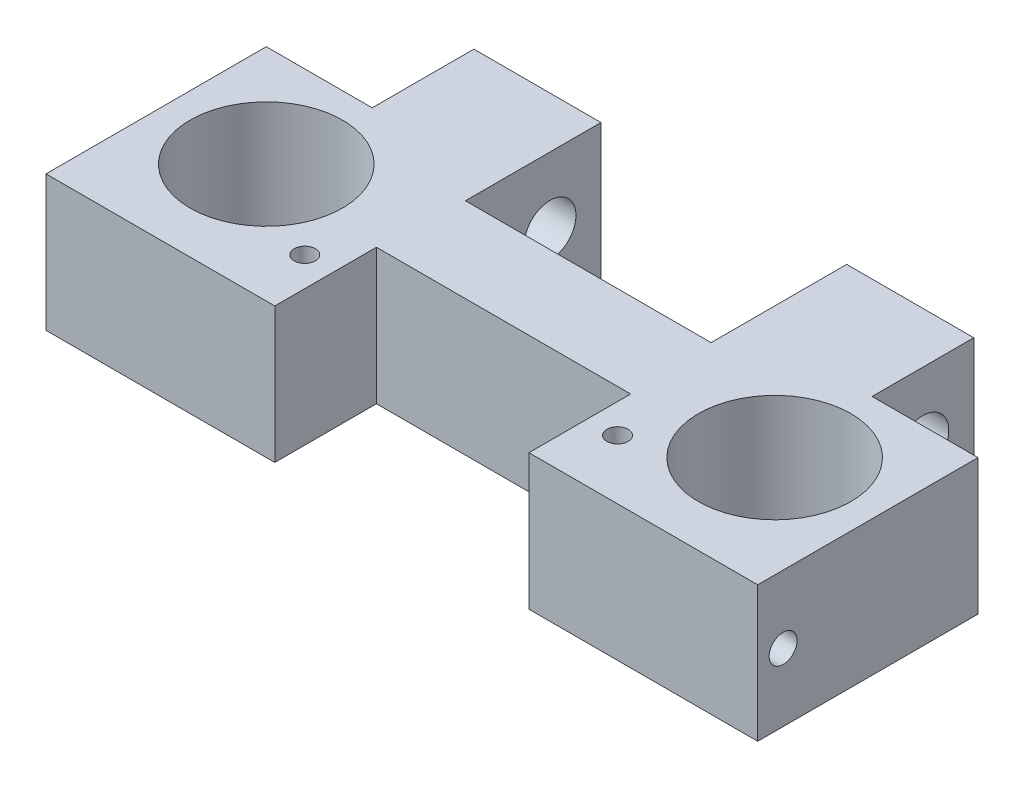
from build123d import *

# Parameters (mm, degrees)
SKETCH_1_R             = 9
EXTRUDE_1_DEPTH        = 8
SKETCH_7_R             = 3.05
CUT_EXTRUDE_1_DEPTH    = 77.165937269
CUT_EXTRUDE_2_REACH    = 53.43
SKETCH_10_W            = 30
SKETCH_10_H            = 12
HOLE_WIZARD_M3_1_D     = 2.5
HOLE_WIZARD_M3_1_DEPTH = 8.5
HOLE_WIZARD_M3_1_TIP   = 0.751075774


with BuildPart() as part:
    # 草图1 → 凸台-拉伸1 (new, symmetric)
    with BuildSketch(Plane(origin=(0, 0, 0), x_dir=(1, 0, 0), z_dir=(0, 1, 0))):
        Polygon((-42, -13), (42, -13), (42, 13), (29.5, 13), (29.5, 25), (14.5, 25), (14.5, 9), (-14.5, 9), (-14.5, 25), (-29.5, 25), (-29.5, 13), (-42, 13), align=None)
        with Locations(Location((-30, 1, 0), (0, 0, 270))):
            Circle(SKETCH_1_R, mode=Mode.SUBTRACT)
        with Locations(Location((30, 1, 0), (0, 0, 90))):
            Circle(SKETCH_1_R, mode=Mode.SUBTRACT)
    extrude(amount=EXTRUDE_1_DEPTH, both=True)

    # 草图7 → 切除-拉伸1 (cut, through all)
    with BuildSketch(Plane.ZY.offset(29.5)):
        with Locations((-19, 0)):
            Circle(SKETCH_7_R)
    extrude(amount=-CUT_EXTRUDE_1_DEPTH, mode=Mode.SUBTRACT)

    # 草图10 → 切除-拉伸2 (cut, up to next)
    with BuildSketch(Plane.XZ.offset(8), mode=Mode.PRIVATE) as cut_extrude_2_sk1:
        with Locations((0, 7)):
            Rectangle(SKETCH_10_W, SKETCH_10_H)
    cut_extrude_2_tool1 = extrude(cut_extrude_2_sk1.sketch, amount=-CUT_EXTRUDE_2_REACH, mode=Mode.PRIVATE) & part.part
    add(cut_extrude_2_tool1.solids().sort_by_distance((0, -8, 7))[0], mode=Mode.SUBTRACT)

    # 草图8 → M4 螺纹孔1 (revolve, cut)
    with BuildSketch(Plane(origin=(42, 0, 10), x_dir=(0, 0, -1), z_dir=(0, 1, 0))):
        Polygon((0, 0), (0, 10.491420021), (1.65, 9.5), (1.65, 0), align=None)
    hole_wizard_m4_1 = revolve(axis=Axis((48.35, 0, 10), (-1, 0, 0)), mode=Mode.SUBTRACT)

    # 镜向1: M4 螺纹孔1 across plane
    add(hole_wizard_m4_1.mirror(Plane(origin=(0, 0, 0), x_dir=(0, 0, 1), z_dir=(1, 0, 0))), mode=Mode.SUBTRACT)

    # M3 螺纹孔1
    with Locations(Plane(origin=(0, 8, 0), x_dir=(1, 0, 0), z_dir=(0, 1, 0))):
        with Locations((-18.456603619, -6), (18.456603619, -6)):
            Hole(HOLE_WIZARD_M3_1_D / 2, depth=HOLE_WIZARD_M3_1_DEPTH)
            with Locations((0, 0, -(HOLE_WIZARD_M3_1_DEPTH + HOLE_WIZARD_M3_1_TIP / 2))):  # 118° drill point
                Cone(0, HOLE_WIZARD_M3_1_D / 2, HOLE_WIZARD_M3_1_TIP, mode=Mode.SUBTRACT)


solid = part.part
